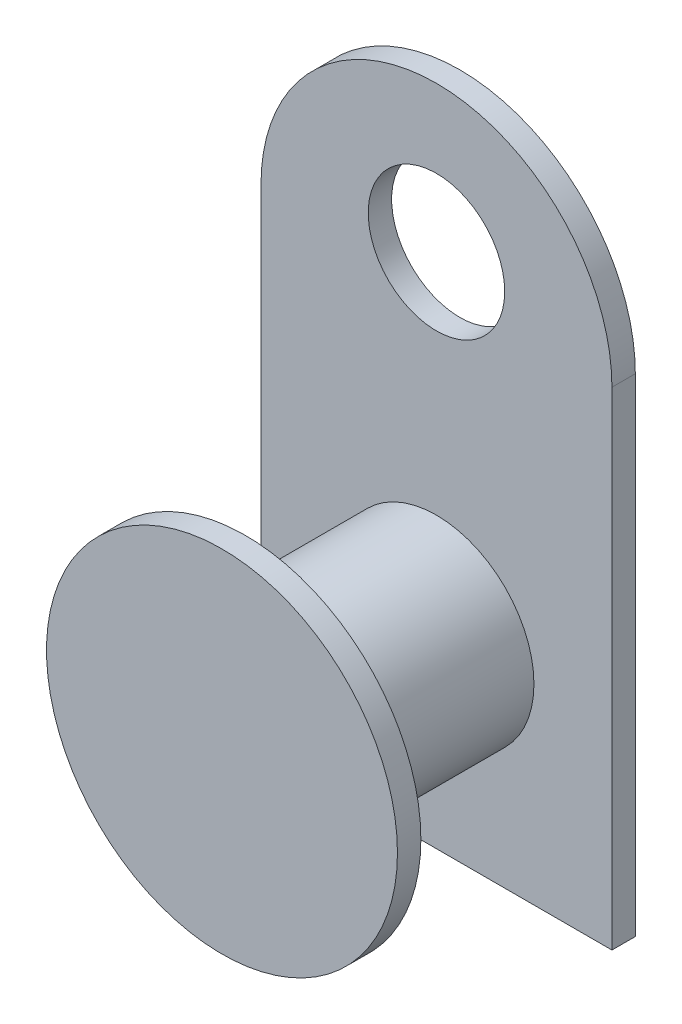
from build123d import *

# Parameters (mm, degrees)
ESQUISSE2_R             = 17.5
BOSS_EXTRU_1_DEPTH      = 6
ESQUISSE3_R             = 25
ESQUISSE3_R_2           = 22
ENL_V_MAT_EXTRU_1_DEPTH = 3
ESQUISSE4_R             = 25
ESQUISSE4_R_2           = 22
BOSS_EXTRU_2_DEPTH      = 55
BOSS_EXTRU_3_START      = -3
ESQUISSE5_R             = 45
BOSS_EXTRU_3_DEPTH      = 6


with BuildPart() as part:
    # Esquisse2 → Boss.-Extru.1 (new body)
    with BuildSketch(Plane.XY):
        with BuildLine():
            Line((-45, 0), (45, 0))
            Line((45, 0), (45, 125))
            ThreePointArc((45, 125), (0, 170), (-45, 125))
            Line((-45, 125), (-45, 0))
        make_face()
        with Locations((0, 132.5)):
            Circle(ESQUISSE2_R, mode=Mode.SUBTRACT)
    extrude(amount=BOSS_EXTRU_1_DEPTH)

    # Esquisse3 → Enlèv. mat.-Extru.1 (cut)
    with BuildSketch(Plane.XY.offset(6)):
        with Locations((0, 49.098888586)):
            Circle(ESQUISSE3_R)
        with Locations((0, 49.098888586)):
            Circle(ESQUISSE3_R_2, mode=Mode.SUBTRACT)
    extrude(amount=-ENL_V_MAT_EXTRU_1_DEPTH, mode=Mode.SUBTRACT)


with BuildPart() as body_2:
    # Esquisse4 → Boss.-Extru.2 (new body)
    with BuildSketch(Plane.XY.offset(3)):
        with Locations((0, 49.098888586)):
            Circle(ESQUISSE4_R)
        with Locations((0, 49.098888586)):
            Circle(ESQUISSE4_R_2, mode=Mode.SUBTRACT)
    extrude(amount=BOSS_EXTRU_2_DEPTH)


with BuildPart() as body_3:
    # Esquisse5 → Boss.-Extru.3 (new body)
    with BuildSketch(Plane.XY.offset(58).offset(BOSS_EXTRU_3_START)):
        with Locations((0, 49.098888586)):
            Circle(ESQUISSE5_R)
    extrude(amount=BOSS_EXTRU_3_DEPTH)


solid = Compound([part.part, body_2.part, body_3.part])
